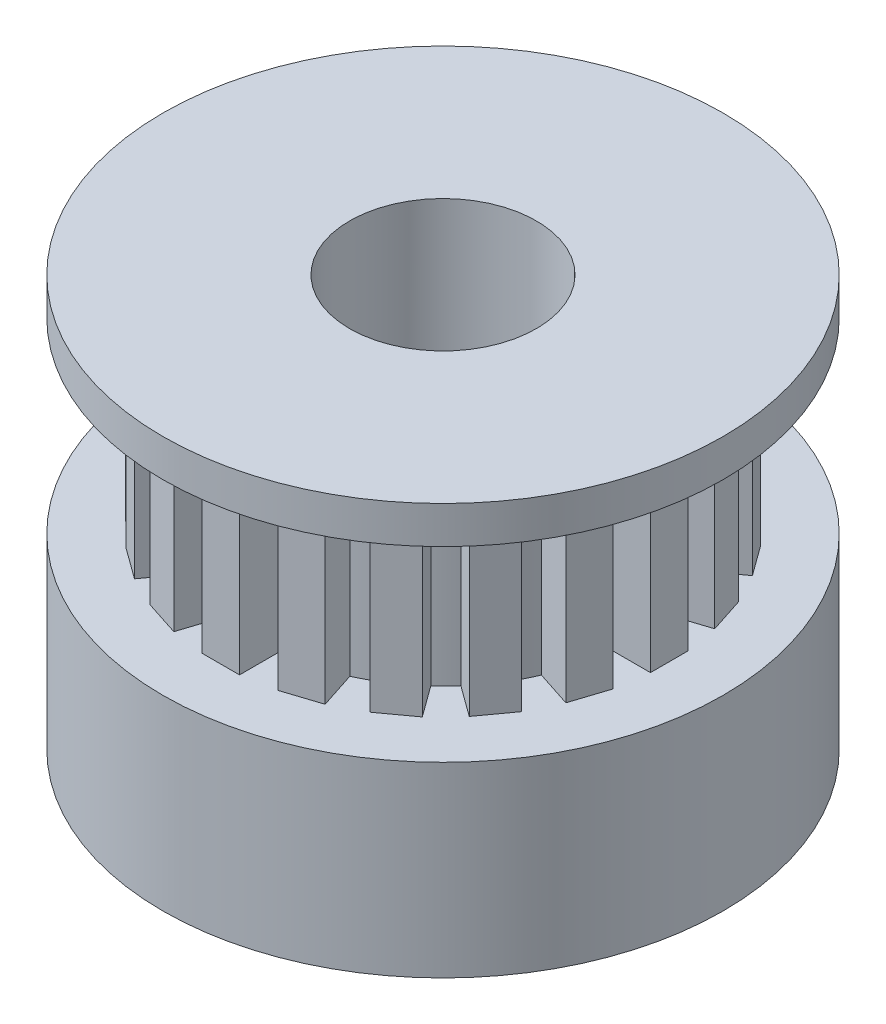
from build123d import *

# Parameters (mm, degrees)
IZIM1_R                     = 7.5
Y_KSEKLIK_EKSTR_ZYON1_DEPTH = 5
IZIM6_R                     = 5
Y_KSEKLIK_EKSTR_ZYON5_DEPTH = 5
Y_KSEKLIK_EKSTR_ZYON6_START = -7
Y_KSEKLIK_EKSTR_ZYON6_DEPTH = 7
DAIRESEL_KAPLAMA2_COUNT     = 20
IZIM8_R                     = 7.5
Y_KSEKLIK_EKSTR_ZYON7_DEPTH = 1
IZIM9_R                     = 2.5
KES_EKSTR_ZYON2_DEPTH       = 21
IZIM10_R                    = 1.2
KES_EKSTR_ZYON3_DEPTH       = 21


with BuildPart() as part:
    # Çizim1 → Yükseklik-Ekstrüzyon1 (new body)
    with BuildSketch(Plane(origin=(0, 0, 0), x_dir=(1, 0, 0), z_dir=(0, 1, 0))):
        with Locations(Location((0, 0, 0), (0, 0, 270))):
            Circle(IZIM1_R)
    extrude(amount=Y_KSEKLIK_EKSTR_ZYON1_DEPTH)

    # Çizim6 → Yükseklik-Ekstrüzyon5 (add)
    with BuildSketch(Plane(origin=(0, 5, 0), x_dir=(1, 0, 0), z_dir=(0, 1, 0))):
        with Locations(Location((0, 0, 0), (0, 0, 270))):
            Circle(IZIM6_R)
    extrude(amount=Y_KSEKLIK_EKSTR_ZYON5_DEPTH)

    # Çizim7 → Yükseklik-Ekstrüzyon6 (add)
    with BuildSketch(Plane(origin=(0, 10, 0), x_dir=(1, 0, 0), z_dir=(0, 1, 0)).offset(Y_KSEKLIK_EKSTR_ZYON6_START)):
        with BuildLine():
            Line((0, 6), (0, 5))
            ThreePointArc((0, 5), (0.223628846, 4.99499651), (0.446810123, 4.979996056))
            Line((0.446810123, 4.979996056), (0.446810123, 6))
            Line((0.446810123, 6), (0, 6))
        make_face()
        with BuildLine():
            ThreePointArc((-0.553189877, 4.969303871), (-0.277020438, 4.99232007), (0, 5))
            Line((0, 5), (0, 6))
            Line((0, 6), (-0.553189877, 6))
            Line((-0.553189877, 6), (-0.553189877, 4.969303871))
        make_face()
    y_kseklik_ekstr_zyon6 = extrude(amount=Y_KSEKLIK_EKSTR_ZYON6_DEPTH)

    # Dairesel Kaplama2: Yükseklik-Ekstrüzyon6 ×20 about axis
    dairesel_kaplama2_axis = Axis((0, 0, 0), (0, 1, 0))
    for i in range(1, DAIRESEL_KAPLAMA2_COUNT):
        add(y_kseklik_ekstr_zyon6.rotate(dairesel_kaplama2_axis, i * 360 / DAIRESEL_KAPLAMA2_COUNT))

    # Çizim8 → Yükseklik-Ekstrüzyon7 (add)
    with BuildSketch(Plane(origin=(0, 10, 0), x_dir=(1, 0, 0), z_dir=(0, 1, 0))):
        with Locations(Location((0, 0, 0), (0, 0, 270))):
            Circle(IZIM8_R)
    extrude(amount=Y_KSEKLIK_EKSTR_ZYON7_DEPTH)

    # Çizim9 → Kes-Ekstrüzyon2 (cut)
    with BuildSketch(Plane(origin=(0, 11, 0), x_dir=(1, 0, 0), z_dir=(0, 1, 0))):
        with Locations(Location((0, 0, 0), (0, 0, 270))):
            Circle(IZIM9_R)
    extrude(amount=-KES_EKSTR_ZYON2_DEPTH, mode=Mode.SUBTRACT)

    # Çizim10 → Kes-Ekstrüzyon3 (cut)
    with BuildSketch(Plane(origin=(0, 0, 0), x_dir=(0, 0, -1), z_dir=(1, 0, 0))):
        with Locations((0, 2.361227205)):
            Circle(IZIM10_R)
    extrude(amount=-KES_EKSTR_ZYON3_DEPTH, mode=Mode.SUBTRACT)


solid = part.part
